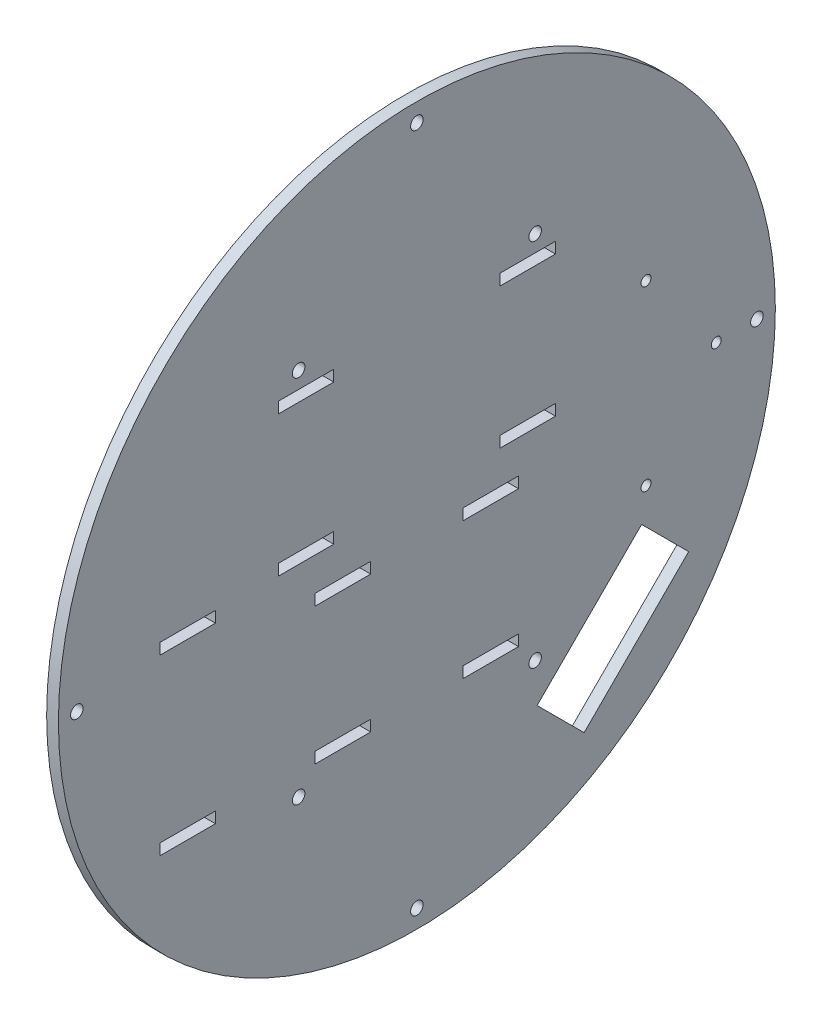
from build123d import *

# Parameters (mm, degrees)
TRAY_SKETCH_R   = 97
TRAY_SKETCH_R_2 = 1.7
TRAY_SKETCH_R_3 = 1.35
TRAY_SKETCH_W   = 15
TRAY_SKETCH_H   = 3
TRAY_DEPTH      = 3.18


with BuildPart() as part:
    # Tray Sketch → Tray (new body)
    with BuildSketch(Plane(origin=(0, 0, 0), x_dir=(0, 0, -1), z_dir=(1, 0, 0))):
        Circle(TRAY_SKETCH_R)
        with Locations((0, 92)):
            Circle(TRAY_SKETCH_R_2, mode=Mode.SUBTRACT)
        with Locations((-92, 0)):
            Circle(TRAY_SKETCH_R_2, mode=Mode.SUBTRACT)
        with Locations((0, -92)):
            Circle(TRAY_SKETCH_R_2, mode=Mode.SUBTRACT)
        with Locations((92, 0)):
            Circle(TRAY_SKETCH_R_2, mode=Mode.SUBTRACT)
        with Locations((32, -50)):
            Circle(TRAY_SKETCH_R_2, mode=Mode.SUBTRACT)
        with Locations((-32, -50)):
            Circle(TRAY_SKETCH_R_2, mode=Mode.SUBTRACT)
        with Locations((32, 50)):
            Circle(TRAY_SKETCH_R_2, mode=Mode.SUBTRACT)
        with Locations((-32, 50)):
            Circle(TRAY_SKETCH_R_2, mode=Mode.SUBTRACT)
        with Locations((62, -24)):
            Circle(TRAY_SKETCH_R_3, mode=Mode.SUBTRACT)
        with Locations((62, 24)):
            Circle(TRAY_SKETCH_R_3, mode=Mode.SUBTRACT)
        with Locations((81, 0)):
            Circle(TRAY_SKETCH_R_3, mode=Mode.SUBTRACT)
        Polygon((32.526911935, -60.811183182), (60.811183182, -32.526911935), (73.539105243, -45.254833996), (45.254833996, -73.539105243), align=None, mode=Mode.SUBTRACT)
        with Locations((-30, 6)):
            Rectangle(TRAY_SKETCH_W, TRAY_SKETCH_H, mode=Mode.SUBTRACT)
        with Locations((-30, 44)):
            Rectangle(TRAY_SKETCH_W, TRAY_SKETCH_H, mode=Mode.SUBTRACT)
        with Locations((30, 6)):
            Rectangle(TRAY_SKETCH_W, TRAY_SKETCH_H, mode=Mode.SUBTRACT)
        with Locations((30, 44)):
            Rectangle(TRAY_SKETCH_W, TRAY_SKETCH_H, mode=Mode.SUBTRACT)
        with Locations((-20, -43)):
            Rectangle(TRAY_SKETCH_W, TRAY_SKETCH_H, mode=Mode.SUBTRACT)
        with Locations((-20, -6)):
            Rectangle(TRAY_SKETCH_W, TRAY_SKETCH_H, mode=Mode.SUBTRACT)
        with Locations((20, -43)):
            Rectangle(TRAY_SKETCH_W, TRAY_SKETCH_H, mode=Mode.SUBTRACT)
        with Locations((20, -6)):
            Rectangle(TRAY_SKETCH_W, TRAY_SKETCH_H, mode=Mode.SUBTRACT)
        with Locations((-62, -43.5)):
            Rectangle(TRAY_SKETCH_W, TRAY_SKETCH_H, mode=Mode.SUBTRACT)
        with Locations((-62, 3.5)):
            Rectangle(TRAY_SKETCH_W, TRAY_SKETCH_H, mode=Mode.SUBTRACT)
    extrude(amount=TRAY_DEPTH)


solid = part.part
